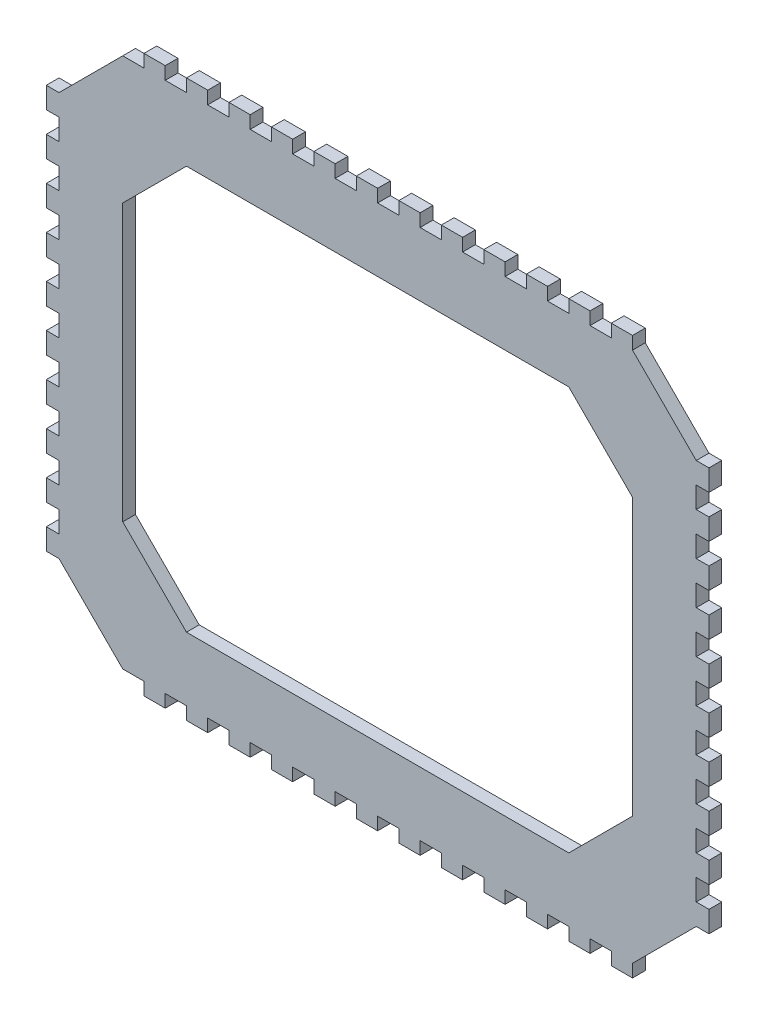
from build123d import *

# Parameters (mm, degrees)
AUFSATZ_LINEAR_AUSTRAGEN2_DEPTH = 6


with BuildPart() as part:
    # Skizze1 → Aufsatz-Linear austragen2 (new body)
    with BuildSketch(Plane.XY):
        Polygon((30, 0), (0, 30), (-6, 30), (-6, 40), (0, 40), (0, 50), (-6, 50), (-6, 60), (0, 60), (0, 70), (-6, 70), (-6, 80), (0, 80), (0, 90), (-6, 90), (-6, 100), (0, 100), (0, 110), (-6, 110), (-6, 120), (0, 120), (0, 130), (-6, 130), (-6, 140), (0, 140), (0, 150), (-6, 150), (-6, 160), (0, 160), (0, 170), (-6, 170), (-6, 180), (0, 180), (0, 190), (-6, 190), (-6, 200), (0, 200), (0, 210), (-6, 210), (-6, 220), (0, 220), (30, 250), (40, 250), (40, 256), (50, 256), (50, 250), (60, 250), (60, 256), (70, 256), (70, 250), (80, 250), (80, 256), (90, 256), (90, 250), (100, 250), (100, 256), (110, 256), (110, 250), (120, 250), (120, 256), (130, 256), (130, 250), (140, 250), (140, 256), (150, 256), (150, 250), (160, 250), (160, 256), (170, 256), (170, 250), (180, 250), (180, 256), (190, 256), (190, 250), (200, 250), (200, 256), (210, 256), (210, 250), (220, 250), (220, 256), (230, 256), (230, 250), (240, 250), (240, 256), (250, 256), (250, 250), (260, 250), (260, 256), (270, 256), (270, 250), (300, 220), (306, 220), (306, 210), (300, 210), (300, 200), (306, 200), (306, 190), (300, 190), (300, 180), (306, 180), (306, 170), (300, 170), (300, 160), (306, 160), (306, 150), (300, 150), (300, 140), (306, 140), (306, 130), (300, 130), (300, 120), (306, 120), (306, 110), (300, 110), (300, 100), (306, 100), (306, 90), (300, 90), (300, 80), (306, 80), (306, 70), (300, 70), (300, 60), (306, 60), (306, 50), (300, 50), (300, 40), (306, 40), (306, 30), (300, 30), (270, 0), (270, -6), (260, -6), (260, 0), (250, 0), (250, -6), (240, -6), (240, 0), (230, 0), (230, -6), (220, -6), (220, 0), (210, 0), (210, -6), (200, -6), (200, 0), (190, 0), (190, -6), (180, -6), (180, 0), (170, 0), (170, -6), (160, -6), (160, 0), (150, 0), (150, -6), (140, -6), (140, 0), (130, 0), (130, -6), (120, -6), (120, 0), (110, 0), (110, -6), (100, -6), (100, 0), (90, 0), (90, -6), (80, -6), (80, 0), (70, 0), (70, -6), (60, -6), (60, 0), (50, 0), (50, -6), (40, -6), (40, 0), align=None)
        Polygon((30, 190), (60, 220), (240, 220), (270, 190), (270, 60), (240, 30), (60, 30), (30, 60), align=None, mode=Mode.SUBTRACT)
    extrude(amount=AUFSATZ_LINEAR_AUSTRAGEN2_DEPTH)


solid = part.part
